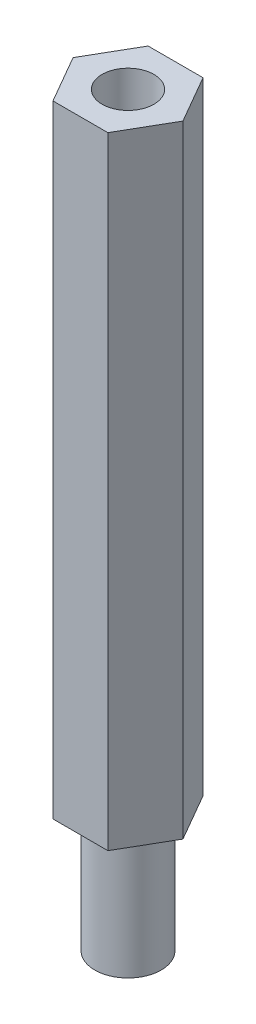
from build123d import *

# Parameters (mm, degrees)
EXTRUDE_1_DEPTH     = 30
SKETCH_6_R          = 1.6
EXTRUDE_2_DEPTH     = 6
SKETCH_7_R          = 1.25
CUT_EXTRUDE_1_DEPTH = 5


with BuildPart() as part:
    # 草图4 → 凸台-拉伸1 (new body)
    with BuildSketch(Plane(origin=(0, 0, 0), x_dir=(1, 0, 0), z_dir=(0, 1, 0))):
        Polygon((1.325, -2.29496732), (2.65, 0), (1.325, 2.29496732), (-1.325, 2.29496732), (-2.65, 0), (-1.325, -2.29496732), align=None)
    extrude(amount=EXTRUDE_1_DEPTH)

    # 草图6 → 凸台-拉伸2 (add)
    with BuildSketch(Plane(origin=(0, 0, 0), x_dir=(-1, 0, 0), z_dir=(0, -1, 0))):
        with Locations(Location((0, 0, 0), (0, 0, 270))):
            Circle(SKETCH_6_R)
    extrude(amount=EXTRUDE_2_DEPTH)

    # 草图7 → 切除-拉伸1 (cut)
    with BuildSketch(Plane(origin=(0, 30, 0), x_dir=(1, 0, 0), z_dir=(0, 1, 0))):
        with Locations(Location((0, 0, 0), (0, 0, 270))):
            Circle(SKETCH_7_R)
    extrude(amount=-CUT_EXTRUDE_1_DEPTH, mode=Mode.SUBTRACT)


solid = part.part
